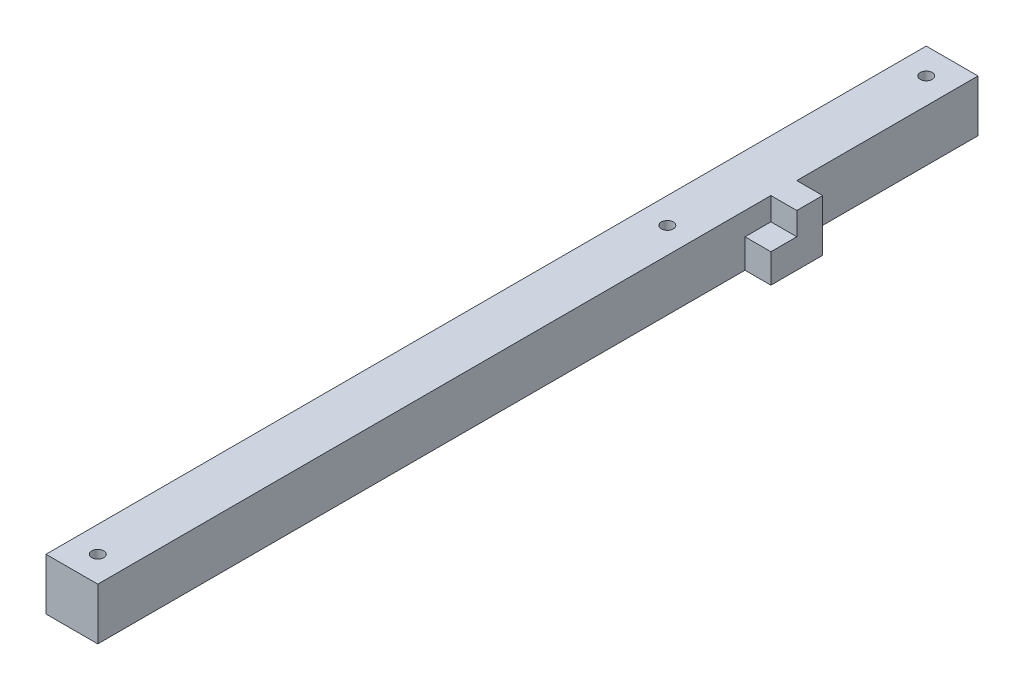
from build123d import *

# Parameters (mm, degrees)
SKETCH18_W                  = 12.7
SKETCH18_H                  = 215.9
BOSS_EXTRUDE3_DEPTH         = 12.7
F_32_0_116_DIAMETER_HOLE7_D = 2.9464
SKETCH29_W                  = 6.35
SKETCH29_H                  = 12.7
BOSS_EXTRUDE4_DEPTH         = 6.35
SKETCH30_W                  = 6.35
SKETCH30_H                  = 7.112
BOSS_EXTRUDE5_DEPTH         = 6.35
SKETCH33_W                  = 12.7
SKETCH33_H                  = 12.7
CUT_EXTRUDE1_DEPTH          = 6.35


with BuildPart() as part:
    # Sketch18 → Boss-Extrude3 (new body)
    with BuildSketch(Plane(origin=(0, 0, 0), x_dir=(1, 0, 0), z_dir=(0, 1, 0))):
        with Locations((-6.35, 95.25)):
            Rectangle(SKETCH18_W, SKETCH18_H)
    extrude(amount=BOSS_EXTRUDE3_DEPTH)

    # #32 (0.116) Diameter Hole7 (through all)
    with Locations(Plane(origin=(0, 12.7, 0), x_dir=(1, 0, 0), z_dir=(0, 1, 0))):
        with Locations((-6.35, 196.85), (-6.35, 133.35), (-6.35, -6.35)):
            Hole(F_32_0_116_DIAMETER_HOLE7_D / 2)

    # Sketch29 → Boss-Extrude4 (add)
    with BuildSketch(Plane.ZY.offset(12.7)):
        with Locations((-155.575, 6.35)):
            Rectangle(SKETCH29_W, SKETCH29_H)
    boss_extrude4 = extrude(amount=BOSS_EXTRUDE4_DEPTH)

    # Sketch30 → Boss-Extrude5 (add)
    with BuildSketch(Plane.ZY.offset(12.7)):
        with Locations((-149.225, 3.556)):
            Rectangle(SKETCH30_W, SKETCH30_H)
    boss_extrude5 = extrude(amount=BOSS_EXTRUDE5_DEPTH)

    # Mirror2: Boss-Extrude4, Boss-Extrude5 across plane
    add(boss_extrude4.mirror(Plane.ZY.offset(6.35)))
    add(boss_extrude5.mirror(Plane.ZY.offset(6.35)))

    # Sketch33 → Cut-Extrude1 (cut)
    with BuildSketch(Plane.ZY.offset(19.05)):
        with Locations((-152.4, 6.35)):
            Rectangle(SKETCH33_W, SKETCH33_H)
    extrude(amount=-CUT_EXTRUDE1_DEPTH, mode=Mode.SUBTRACT)


solid = part.part
